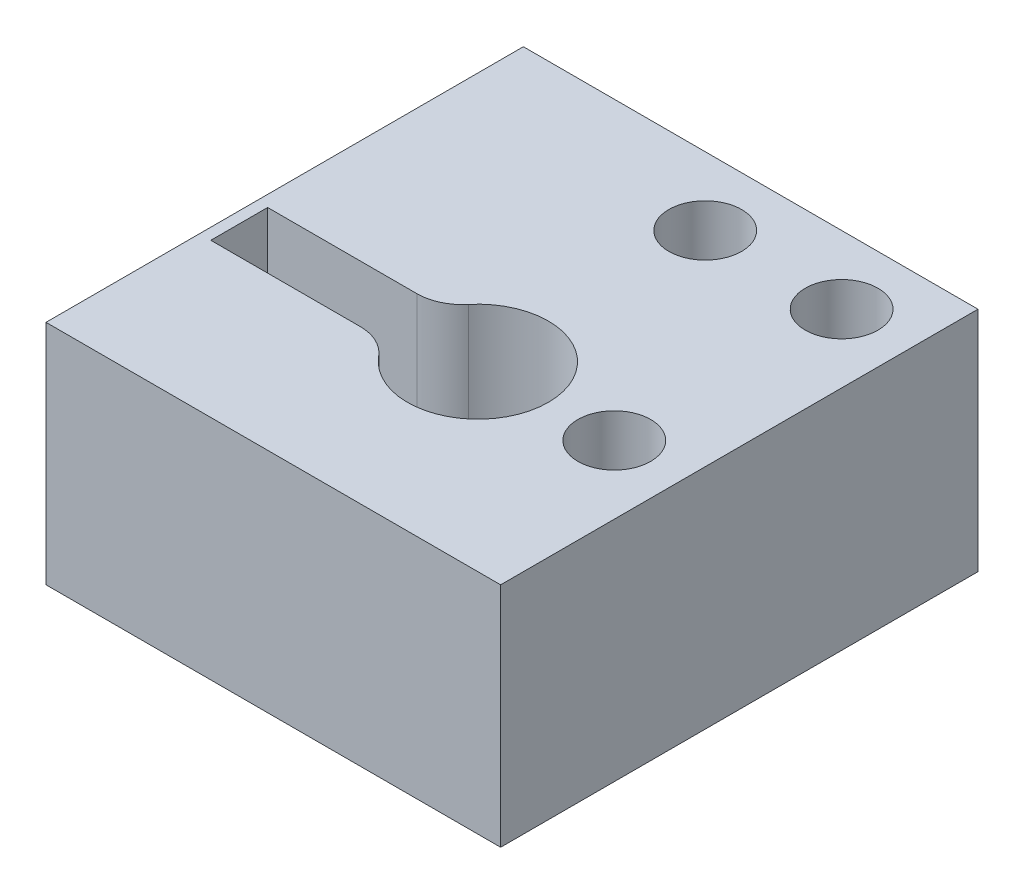
from build123d import *

# Parameters (mm, degrees)
SKETCH_1_W          = 20
SKETCH_1_H          = 21
EXTRUDE_1_DEPTH     = 10
CUT_EXTRUDE_1_DEPTH = 18.613914954
FILLET_2_R          = 2
SKETCH_3_R          = 1.6
CUT_EXTRUDE_2_DEPTH = 18.613914954
SKETCH_4_W          = 0.5
SKETCH_4_H          = 2.5
EXTRUDE_2_DEPTH     = 10


with BuildPart() as part:
    # 草图1 → 凸台-拉伸1 (new body)
    with BuildSketch(Plane(origin=(0, 0, 0), x_dir=(1, 0, 0), z_dir=(0, 1, 0))):
        Rectangle(SKETCH_1_W, SKETCH_1_H)
    extrude(amount=EXTRUDE_1_DEPTH)

    # 草图2 → 切除-拉伸1 (cut, through all)
    with BuildSketch(Plane(origin=(0, 10, 0), x_dir=(1, 0, 0), z_dir=(0, 1, 0))):
        with BuildLine():
            Line((-1.836811591, -1.25), (-10, -1.25))
            Line((-10, -1.25), (-10, -3.75))
            Line((-10, -3.75), (-1.836811591, -3.75))
            ThreePointArc((-1.836811591, -3.75), (4.1, -2.5), (-1.836811591, -1.25))
        make_face()
    extrude(amount=-CUT_EXTRUDE_1_DEPTH, mode=Mode.SUBTRACT)

    # 圆角2
    fillet_2_edges = [part.edges().sort_by_distance(p)[0] for p in [
        (-1.836811591, 5, 1.25),
        (-1.836811591, 5, 3.75),
    ]]
    fillet(fillet_2_edges, radius=FILLET_2_R)

    # 草图3 → 切除-拉伸2 (cut, through all)
    with BuildSketch(Plane(origin=(0, 10, 0), x_dir=(1, 0, 0), z_dir=(0, 1, 0))):
        with Locations(Location((1, 7.5, 0), (0, 0, 270))):
            Circle(SKETCH_3_R)
        with Locations(Location((7, 7.5, 0), (0, 0, 270))):
            Circle(SKETCH_3_R)
        with Locations(Location((7, -2.5, 0), (0, 0, 270))):
            Circle(SKETCH_3_R)
    extrude(amount=-CUT_EXTRUDE_2_DEPTH, mode=Mode.SUBTRACT)

    # 草图4 → 凸台-拉伸2 (add)
    with BuildSketch(Plane(origin=(0, 10, 0), x_dir=(1, 0, 0), z_dir=(0, 1, 0))):
        with Locations((-9.75, -2.5)):
            Rectangle(SKETCH_4_W, SKETCH_4_H)
    extrude(amount=-EXTRUDE_2_DEPTH)


solid = part.part
